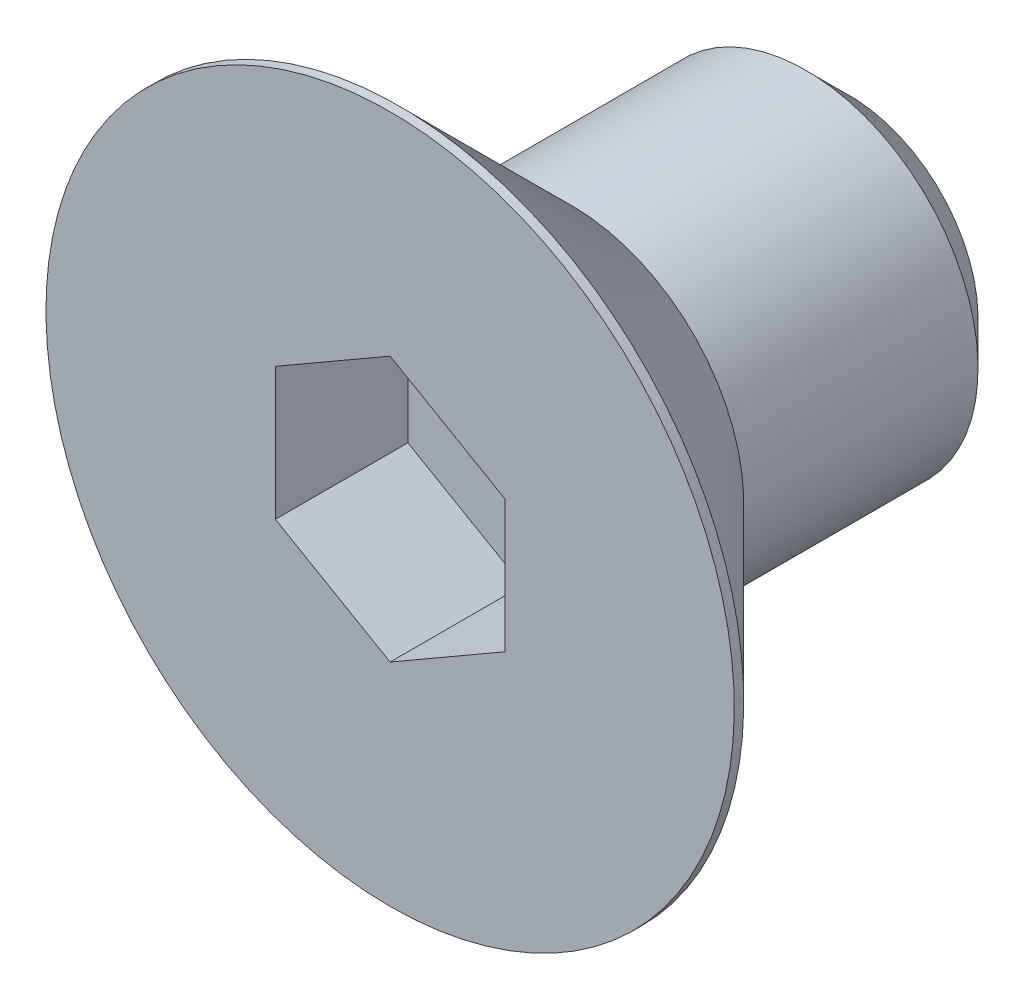
from build123d import *

# Parameters (mm, degrees)
CHAMFER1_SIZE      = 0.75
CUT_EXTRUDE2_DEPTH = 2.31


with BuildPart() as part:
    # Sketch1 → Revolve1 (revolve)
    with BuildSketch(Plane(origin=(0, 0, 0), x_dir=(0, 0, -1), z_dir=(1, 0, 0))):
        Polygon((-0.7, 3), (4, 3), (4, 0), (-1.69, 0), (-1.69, 3), align=None)
    revolve(axis=Axis((0, 0, 1.69), (0, 0, -1)))

    # Chamfer1
    chamfer1_edges = [part.edges().sort_by_distance(p)[0] for p in [
        (0, -3, -4),
    ]]
    chamfer(chamfer1_edges, length=CHAMFER1_SIZE)


with BuildPart() as body_2:
    # Sketch7 → Revolve2 (revolve)
    with BuildSketch(Plane(origin=(0, 0, 0), x_dir=(0, 0, -1), z_dir=(1, 0, 0))):
        Polygon((-3.835, 6), (-4, 6), (-4, 0), (-0.7, 0), (-0.7, 2.865), align=None)
    revolve(axis=Axis((0, 0, 4), (0, 0, -1)))

    # Sketch5 → Cut-Extrude2 (cut)
    with BuildSketch(Plane.XY.offset(4)):
        Polygon((2, -1.154700538), (2, 1.154700538), (0, 2.309401077), (-2, 1.154700538), (-2, -1.154700538), (0, -2.309401077), align=None)
    extrude(amount=-CUT_EXTRUDE2_DEPTH, mode=Mode.SUBTRACT)


solid = Compound([part.part, body_2.part])
